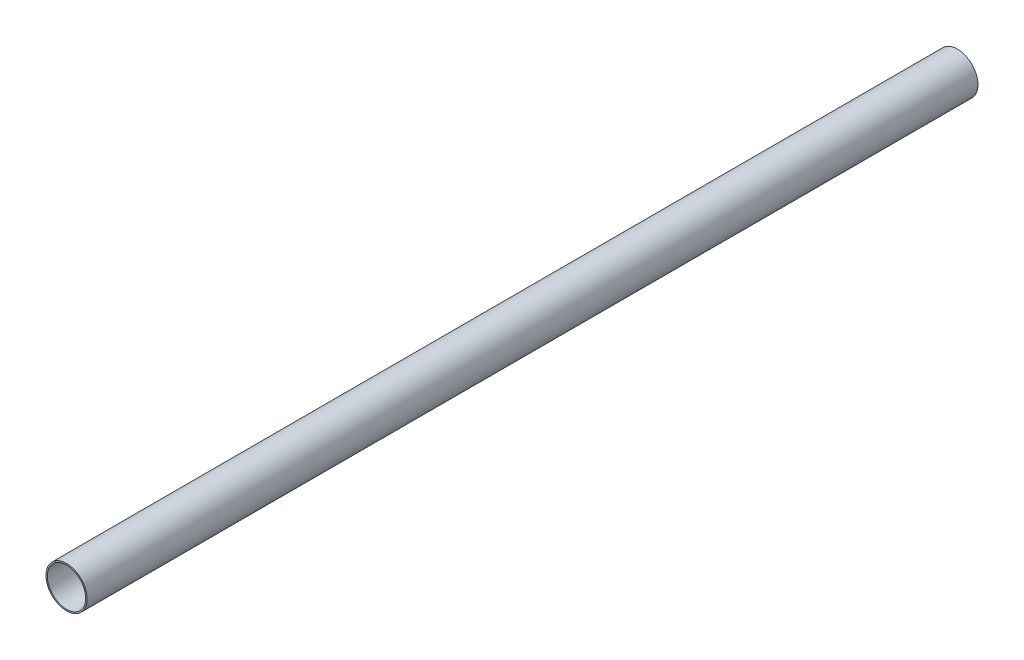
from build123d import *

# Parameters (mm, degrees)
SKETCH_1_R      = 15
SKETCH_1_R_2    = 14
EXTRUDE_1_DEPTH = 325


with BuildPart() as part:
    # Эскиз1 → Бобышка-Вытянуть1 (new, symmetric)
    with BuildSketch(Plane.XY):
        Circle(SKETCH_1_R)
        Circle(SKETCH_1_R_2, mode=Mode.SUBTRACT)
    extrude(amount=EXTRUDE_1_DEPTH, both=True)


solid = part.part
